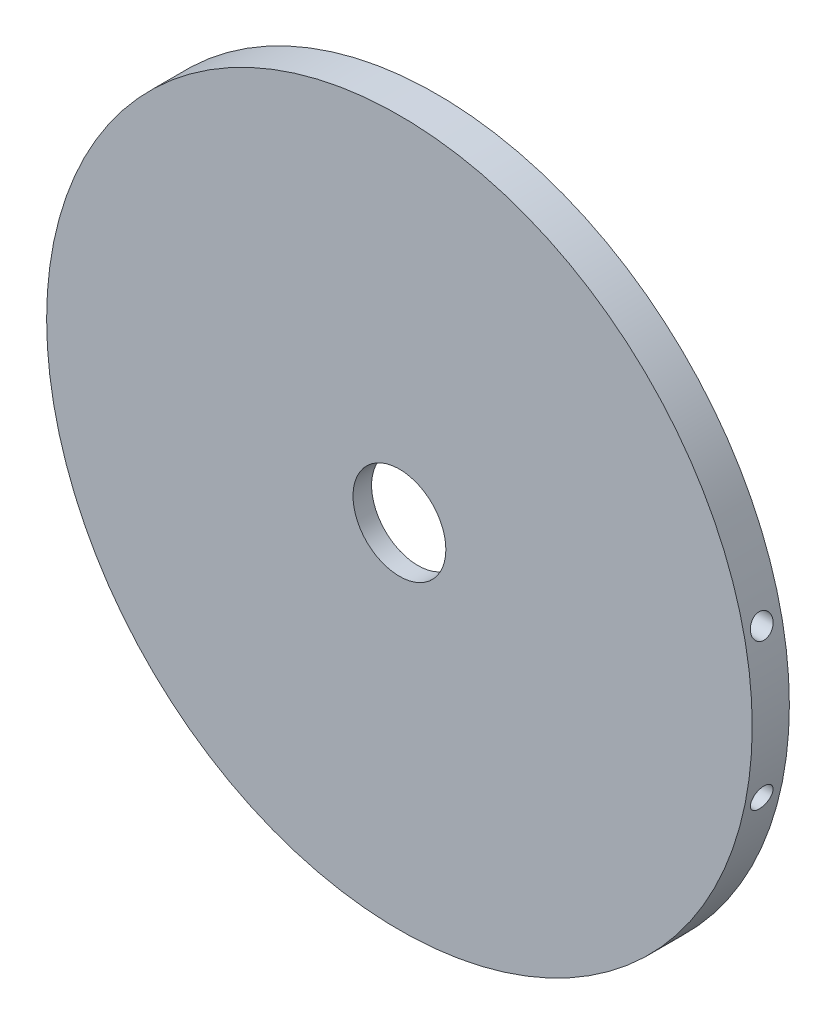
from build123d import *

# Parameters (mm, degrees)
SKETCH1_R                = 19
SKETCH1_R_2              = 7.5
SKETCH1_R_3              = 2.5
BOSS_EXTRUDE5_DEPTH      = 2
SKETCH10_R               = 12
CUT_EXTRUDE33_DEPTH      = 1
CUT_EXTRUDE34_DEPTH      = 40
CUT_EXTRUDE34_DEPTH_BACK = 34
SKETCH14_R               = 0.6


with BuildPart() as part:
    # Sketch1 → Boss-Extrude5 (new body)
    # profile 1 of 2: a face of its own
    with BuildSketch(Plane.XY):
        Circle(SKETCH1_R)
        Circle(SKETCH1_R_2, mode=Mode.SUBTRACT)
    # profile 2 of 2: a face of its own
    with BuildSketch(Plane.XY):
        Circle(SKETCH1_R_2)
        Circle(SKETCH1_R_3, mode=Mode.SUBTRACT)
    extrude(amount=BOSS_EXTRUDE5_DEPTH)

    # Sketch10 → Cut-Extrude33 (cut)
    with BuildSketch(Plane.XY):
        Circle(SKETCH10_R)
    extrude(amount=CUT_EXTRUDE33_DEPTH, mode=Mode.SUBTRACT)

    # Sketch14 → Cut-Extrude34 (cut, two sides: drawn at the far end of the back side and taken through both)
    with BuildSketch(Plane(origin=(0, 0, 0), x_dir=(0, 0, -1), z_dir=(1, 0, 0)).offset(-CUT_EXTRUDE34_DEPTH_BACK)):
        with Locations(Location((-1.062968904, 4, 0), (0, 0, 180))):
            Circle(SKETCH14_R)
        with Locations(Location((-1.062968904, -4, 0), (0, 0, 180))):
            Circle(SKETCH14_R)
    extrude(amount=CUT_EXTRUDE34_DEPTH + CUT_EXTRUDE34_DEPTH_BACK, mode=Mode.SUBTRACT)


solid = part.part
